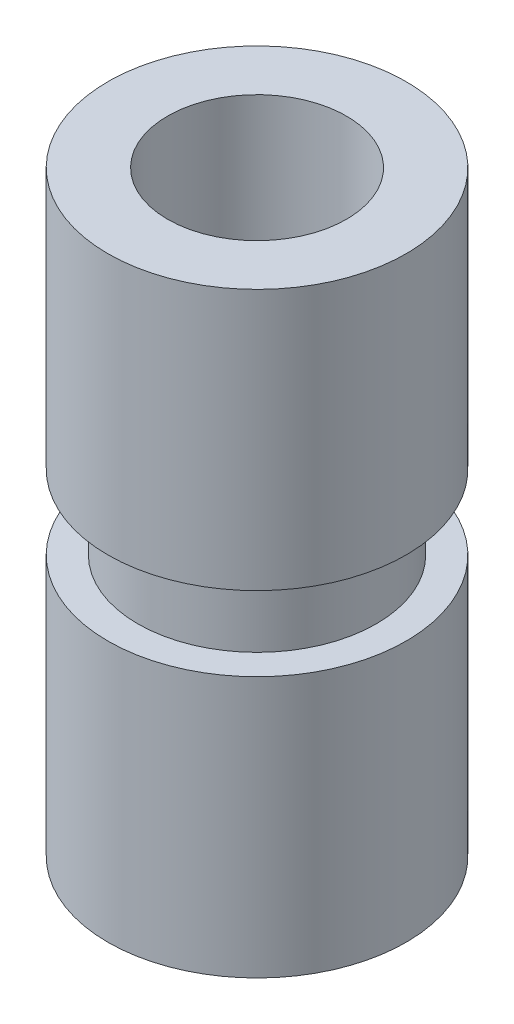
from build123d import *

# Parameters (mm, degrees)
SKETCH2_R               = 1
BOSS_EXTRUDE1_DEPTH     = 4
CUT_EXTRUDE1_DEPTH      = 0.25
CUT_EXTRUDE1_DEPTH_BACK = 0.25
SKETCH4_OUTSIDE_W       = 4.98
SKETCH4_OUTSIDE_H       = 4.98
SKETCH4_OUTSIDE_R       = 0.8
SKETCH5_R               = 0.6
CUT_EXTRUDE2_DEPTH      = 7.5


with BuildPart() as part:
    # Sketch2 → Boss-Extrude1 (new body)
    with BuildSketch(Plane(origin=(0, 0, 0), x_dir=(1, 0, 0), z_dir=(0, 1, 0))):
        with Locations(Location((0, 0, 0), (0, 0, 270))):
            Circle(SKETCH2_R)
    extrude(amount=BOSS_EXTRUDE1_DEPTH)

    # Sketch4 outside → Cut-Extrude1 (cut, two sides: drawn at the far end of the back side and taken through both)
    with BuildSketch(Plane(origin=(0, 2, 0), x_dir=(1, 0, 0), z_dir=(0, 1, 0)).offset(-CUT_EXTRUDE1_DEPTH_BACK)):
        Rectangle(SKETCH4_OUTSIDE_W, SKETCH4_OUTSIDE_H)
        with Locations(Location((0, 0, 0), (0, 0, 270))):
            Circle(SKETCH4_OUTSIDE_R, mode=Mode.SUBTRACT)
    extrude(amount=CUT_EXTRUDE1_DEPTH + CUT_EXTRUDE1_DEPTH_BACK, mode=Mode.SUBTRACT)

    # Sketch5 → Cut-Extrude2 (cut)
    with BuildSketch(Plane(origin=(0, 4, 0), x_dir=(1, 0, 0), z_dir=(0, 1, 0))):
        with Locations(Location((0, 0, 0), (0, 0, 270))):
            Circle(SKETCH5_R)
    extrude(amount=-CUT_EXTRUDE2_DEPTH, mode=Mode.SUBTRACT)


solid = part.part
